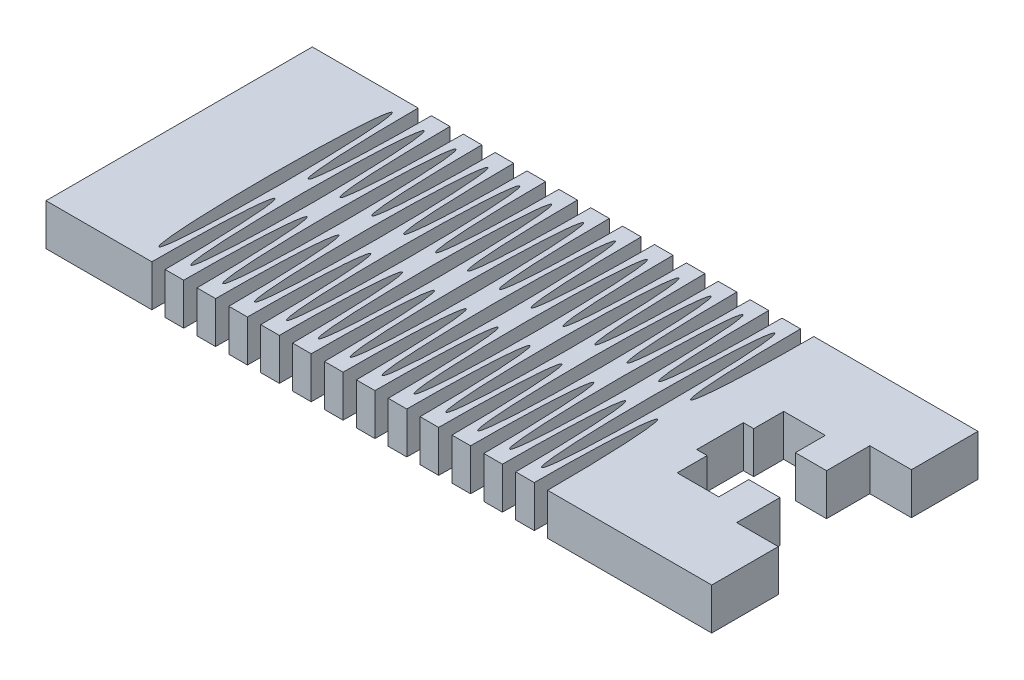
from build123d import *

# Parameters (mm, degrees)
SKETCH1_W           = 38.1
SKETCH1_H           = 20.32
BOSS_EXTRUDE1_DEPTH = 3.175
SKETCH4_W           = 6.35
SKETCH4_H           = 3.556
CUT_EXTRUDE1_DEPTH  = 3.175
SKETCH5_W           = 3.175
SKETCH5_H           = 8.128
CUT_EXTRUDE2_DEPTH  = 3.175
SKETCH6_W           = 12.7
SKETCH6_H           = 20.32
BOSS_EXTRUDE2_DEPTH = 3.175
SKETCH11_RX         = 8.89
SKETCH11_RY         = 0.508
CUT_EXTRUDE12_DEPTH = 4
SKETCH12_RX         = 8.89
SKETCH12_RY         = 0.508
CUT_EXTRUDE13_DEPTH = 4
SKETCH13_RX         = 8.89
SKETCH13_RY         = 0.508
SKETCH13_RX_2       = 8.890000554
SKETCH13_RX_3       = 8.890000547
SKETCH13_RX_4       = 8.890000552
CUT_EXTRUDE15_DEPTH = 4


with BuildPart() as part:
    # Sketch1 → Boss-Extrude1 (new body)
    with BuildSketch(Plane(origin=(0, 0, 0), x_dir=(1, 0, 0), z_dir=(0, 1, 0))):
        with Locations((19.05, -10.16)):
            Rectangle(SKETCH1_W, SKETCH1_H)
    extrude(amount=BOSS_EXTRUDE1_DEPTH)

    # Sketch4 → Cut-Extrude1 (cut)
    with BuildSketch(Plane(origin=(0, 3.175, 0), x_dir=(1, 0, 0), z_dir=(0, 1, 0))):
        with Locations((31.75, -10.16)):
            Rectangle(SKETCH4_W, SKETCH4_H)
        Polygon((38.1, -15.24), (38.1, -5.08), (34.925, -5.08), (34.925, -8.382), (34.925, -11.938), (34.925, -15.24), align=None)
    extrude(amount=-CUT_EXTRUDE1_DEPTH, mode=Mode.SUBTRACT)

    # Sketch5 → Cut-Extrude2 (cut)
    with BuildSketch(Plane(origin=(0, 3.175, 0), x_dir=(1, 0, 0), z_dir=(0, 1, 0))):
        with Locations((30.95625, -10.16)):
            Rectangle(SKETCH5_W, SKETCH5_H)
    extrude(amount=-CUT_EXTRUDE2_DEPTH, mode=Mode.SUBTRACT)

    # Sketch6 → Boss-Extrude2 (add)
    with BuildSketch(Plane(origin=(0, 3.175, 0), x_dir=(1, 0, 0), z_dir=(0, 1, 0))):
        with Locations((-6.35, -10.16)):
            Rectangle(SKETCH6_W, SKETCH6_H)
    extrude(amount=-BOSS_EXTRUDE2_DEPTH)

    # Sketch11 → Cut-Extrude12 (cut)
    with BuildSketch(Plane(origin=(0, 3.175, 0), x_dir=(1, 0, 0), z_dir=(0, 1, 0))):
        with Locations(Location((25.067, 0), (0, 0, -90))):
            Ellipse(SKETCH11_RX, SKETCH11_RY)
        with Locations(Location((25.067, -20.32), (0, 0, 90))):
            Ellipse(SKETCH11_RX, SKETCH11_RY)
    extrude(amount=-CUT_EXTRUDE12_DEPTH, mode=Mode.SUBTRACT)

    # Sketch12 → Cut-Extrude13 (cut)
    with BuildSketch(Plane(origin=(0, 3.175, 0), x_dir=(1, 0, 0), z_dir=(0, 1, 0))):
        with Locations(Location((23.851, -10.16), (0, 0, 90))):
            Ellipse(SKETCH12_RX, SKETCH12_RY)
    extrude(amount=-CUT_EXTRUDE13_DEPTH, mode=Mode.SUBTRACT)

    # Sketch13 → Cut-Extrude15 (cut)
    with BuildSketch(Plane(origin=(0, 3.175, 0), x_dir=(1, 0, 0), z_dir=(0, 1, 0))):
        with Locations(Location((22.635, 0), (0, 0, -89.999999999))):
            Ellipse(SKETCH13_RX, SKETCH13_RY)
        with Locations(Location((22.635, -20.32), (0, 0, -90))):
            Ellipse(SKETCH13_RX, SKETCH13_RY)
        with Locations(Location((21.419, -10.16), (0, 0, 90))):
            Ellipse(SKETCH13_RX, SKETCH13_RY)
        with Locations(Location((20.203, 0), (0, 0, -90))):
            Ellipse(SKETCH13_RX, SKETCH13_RY)
        with Locations(Location((20.203, -20.32), (0, 0, -90))):
            Ellipse(SKETCH13_RX, SKETCH13_RY)
        with Locations(Location((18.987, -10.16), (0, 0, -90))):
            Ellipse(SKETCH13_RX, SKETCH13_RY)
        with Locations(Location((17.771, 0), (0, 0, -90))):
            Ellipse(SKETCH13_RX, SKETCH13_RY)
        with Locations(Location((17.771, -20.32), (0, 0, -90))):
            Ellipse(SKETCH13_RX, SKETCH13_RY)
        with Locations(Location((16.555, -10.16), (0, 0, 90))):
            Ellipse(SKETCH13_RX, SKETCH13_RY)
        with Locations(Location((15.339, 0), (0, 0, -90))):
            Ellipse(SKETCH13_RX, SKETCH13_RY)
        with Locations(Location((15.339, -20.32), (0, 0, -90))):
            Ellipse(SKETCH13_RX_2, SKETCH13_RY)
        with Locations(Location((14.123, -10.16), (0, 0, 90))):
            Ellipse(SKETCH13_RX, SKETCH13_RY)
        with Locations(Location((12.907, 0), (0, 0, -89.999999999))):
            Ellipse(SKETCH13_RX, SKETCH13_RY)
        with Locations(Location((12.907, -20.32), (0, 0, -90))):
            Ellipse(SKETCH13_RX, SKETCH13_RY)
        with Locations(Location((11.691, -10.16), (0, 0, -90))):
            Ellipse(SKETCH13_RX, SKETCH13_RY)
        with Locations(Location((10.475, 0), (0, 0, -90))):
            Ellipse(SKETCH13_RX, SKETCH13_RY)
        with Locations(Location((10.475, -20.32), (0, 0, 90))):
            Ellipse(SKETCH13_RX, SKETCH13_RY)
        with Locations(Location((9.259, -10.16), (0, 0, 90))):
            Ellipse(SKETCH13_RX, SKETCH13_RY)
        with Locations(Location((8.043, 0), (0, 0, -90))):
            Ellipse(SKETCH13_RX, SKETCH13_RY)
        with Locations(Location((8.043, -20.32), (0, 0, -90))):
            Ellipse(SKETCH13_RX, SKETCH13_RY)
        with Locations(Location((6.827, -10.16), (0, 0, -90))):
            Ellipse(SKETCH13_RX, SKETCH13_RY)
        with Locations(Location((5.611, 0), (0, 0, -90))):
            Ellipse(SKETCH13_RX, SKETCH13_RY)
        with Locations(Location((5.611, -20.319999453), (0, 0, -90))):
            Ellipse(SKETCH13_RX_3, SKETCH13_RY)
        with Locations(Location((4.395, -10.16), (0, 0, -90))):
            Ellipse(SKETCH13_RX, SKETCH13_RY)
        with Locations(Location((3.179, 0), (0, 0, -89.999999999))):
            Ellipse(SKETCH13_RX, SKETCH13_RY)
        with Locations(Location((3.179, -20.32), (0, 0, -90))):
            Ellipse(SKETCH13_RX, SKETCH13_RY)
        with Locations(Location((1.963, -10.16), (0, 0, 90))):
            Ellipse(SKETCH13_RX, SKETCH13_RY)
        with Locations(Location((0.747, 0), (0, 0, -90))):
            Ellipse(SKETCH13_RX, SKETCH13_RY)
        with Locations(Location((0.747, -20.32), (0, 0, -90))):
            Ellipse(SKETCH13_RX, SKETCH13_RY)
        with Locations(Location((-0.469, -10.16), (0, 0, -90))):
            Ellipse(SKETCH13_RX, SKETCH13_RY)
        with Locations(Location((-1.685, 0), (0, 0, -90))):
            Ellipse(SKETCH13_RX, SKETCH13_RY)
        with Locations(Location((-1.685, -20.32), (0, 0, -90))):
            Ellipse(SKETCH13_RX, SKETCH13_RY)
        with Locations(Location((-2.901, -10.16), (0, 0, -90))):
            Ellipse(SKETCH13_RX, SKETCH13_RY)
        with Locations(Location((-4.117, 0), (0, 0, -90))):
            Ellipse(SKETCH13_RX, SKETCH13_RY)
        with Locations(Location((-4.117, -20.32), (0, 0, -90))):
            Ellipse(SKETCH13_RX_4, SKETCH13_RY)
        with Locations(Location((-5.333, -10.16), (0, 0, -90))):
            Ellipse(SKETCH13_RX, SKETCH13_RY)
    extrude(amount=-CUT_EXTRUDE15_DEPTH, mode=Mode.SUBTRACT)


solid = part.part
